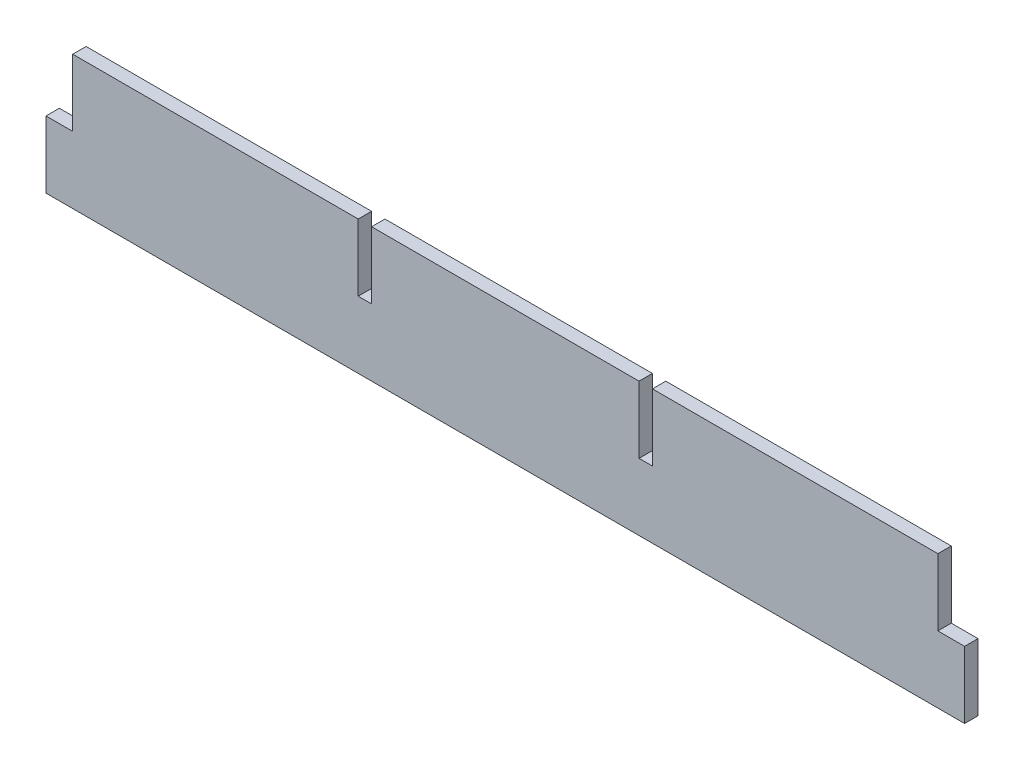
from build123d import *

# Parameters (mm, degrees)
BOSS_EXTRUDE1_DEPTH = 10


with BuildPart() as part:
    # Sketch1 → Boss-Extrude1 (new body)
    with BuildSketch(Plane.XY):
        Polygon((-323.475, 0), (-110, 0), (-110, -50), (-100, -50), (-100, 0), (100, 0), (100, -50), (110, -50), (110, 0), (323.475, 0), (323.475, -50), (343.475, -50), (343.475, -100), (-343.475, -100), (-343.475, -50), (-323.475, -50), align=None)
    extrude(amount=BOSS_EXTRUDE1_DEPTH)


solid = part.part
